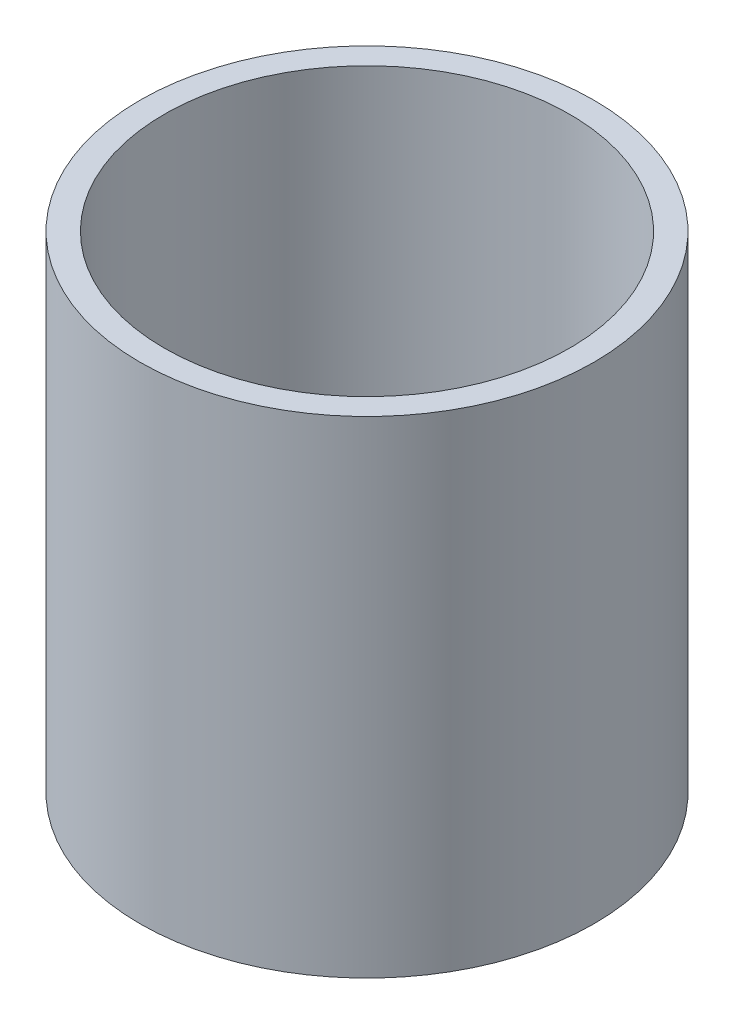
from build123d import *

# Parameters (mm, degrees)
SKETCH1_R           = 28
SKETCH1_R_2         = 25
BOSS_EXTRUDE1_DEPTH = 60


with BuildPart() as part:
    # Sketch1 → Boss-Extrude1 (new body)
    with BuildSketch(Plane(origin=(0, 0, 0), x_dir=(1, 0, 0), z_dir=(0, 1, 0))):
        with Locations(Location((0, 0, 0), (0, 0, 270))):
            Circle(SKETCH1_R)
        with Locations(Location((0, 0, 0), (0, 0, 270))):
            Circle(SKETCH1_R_2, mode=Mode.SUBTRACT)
    extrude(amount=BOSS_EXTRUDE1_DEPTH)


solid = part.part
